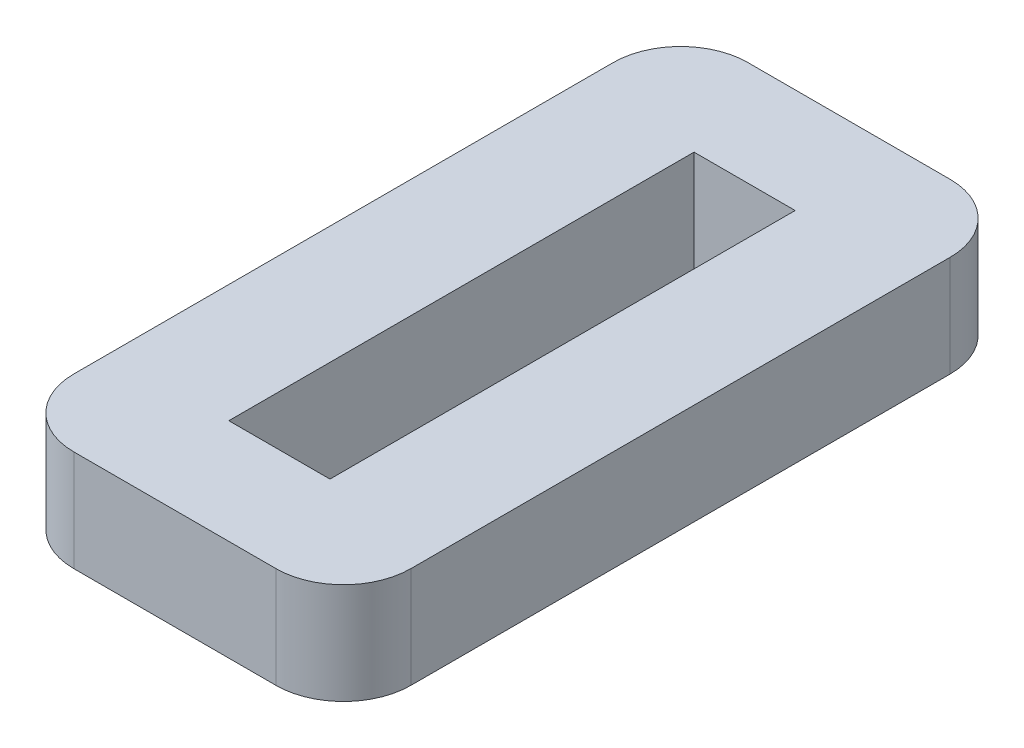
from build123d import *

# Parameters (mm, degrees)
SKETCH_1_W          = 10
SKETCH_1_H          = 20
EXTRUDE_1_DEPTH     = 3
SKETCH_2_W          = 3
SKETCH_2_H          = 13.8
CUT_EXTRUDE_1_DEPTH = 3
FILLET_1_R          = 2


with BuildPart() as part:
    # Эскиз1 → Бобышка-Вытянуть1 (new body)
    with BuildSketch(Plane(origin=(0, 0, 0), x_dir=(1, 0, 0), z_dir=(0, 1, 0))):
        Rectangle(SKETCH_1_W, SKETCH_1_H)
    extrude(amount=EXTRUDE_1_DEPTH)

    # Эскиз2 → Вырез-Вытянуть1 (cut)
    with BuildSketch(Plane(origin=(0, 3, 0), x_dir=(1, 0, 0), z_dir=(0, 1, 0))):
        Rectangle(SKETCH_2_W, SKETCH_2_H)
    extrude(amount=-CUT_EXTRUDE_1_DEPTH, mode=Mode.SUBTRACT)

    # Скругление1
    fillet_1_edges = [part.edges().sort_by_distance(p)[0] for p in [
        (5, 1.5, 10),
        (-5, 1.5, 10),
        (-5, 1.5, -10),
        (5, 1.5, -10),
    ]]
    fillet(fillet_1_edges, radius=FILLET_1_R)


solid = part.part
